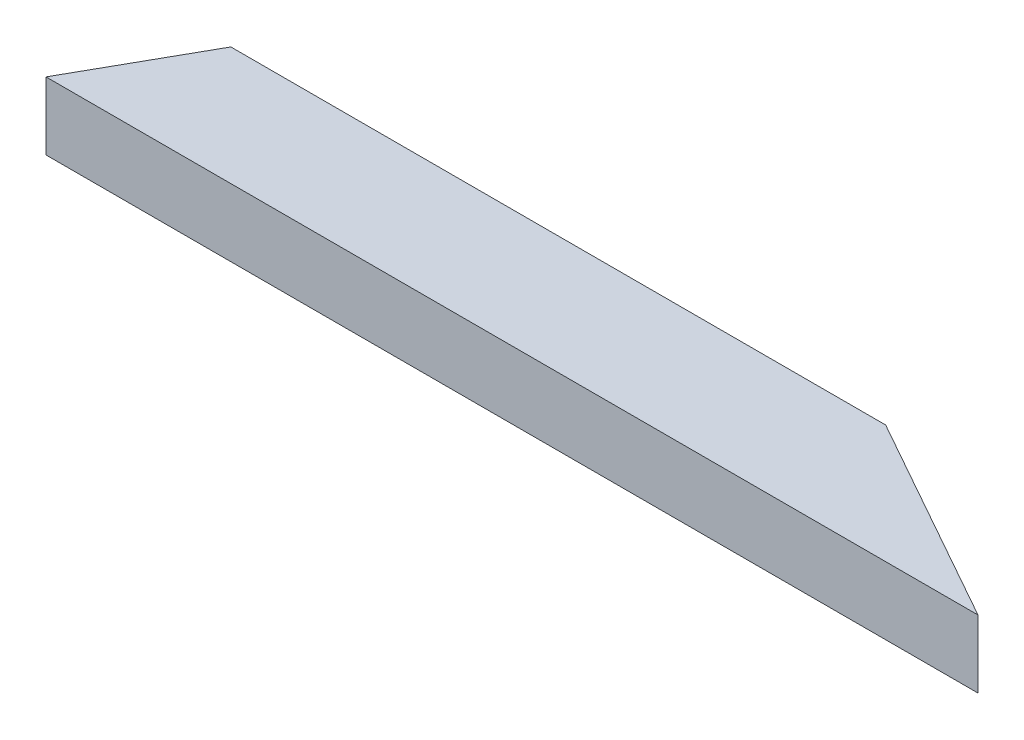
from build123d import *

# Parameters (mm, degrees)
BOSS_EXTRUDE1_DEPTH = 50.8


with BuildPart() as part:
    # Sketch1 → Boss-Extrude1 (new body)
    with BuildSketch(Plane(origin=(0, 0, 0), x_dir=(1, 0, 0), z_dir=(0, 1, 0))):
        Polygon((0, 0), (700, 0), (541.742777663, 88.9), (49.939016263, 88.9), align=None)
    extrude(amount=BOSS_EXTRUDE1_DEPTH)


solid = part.part
